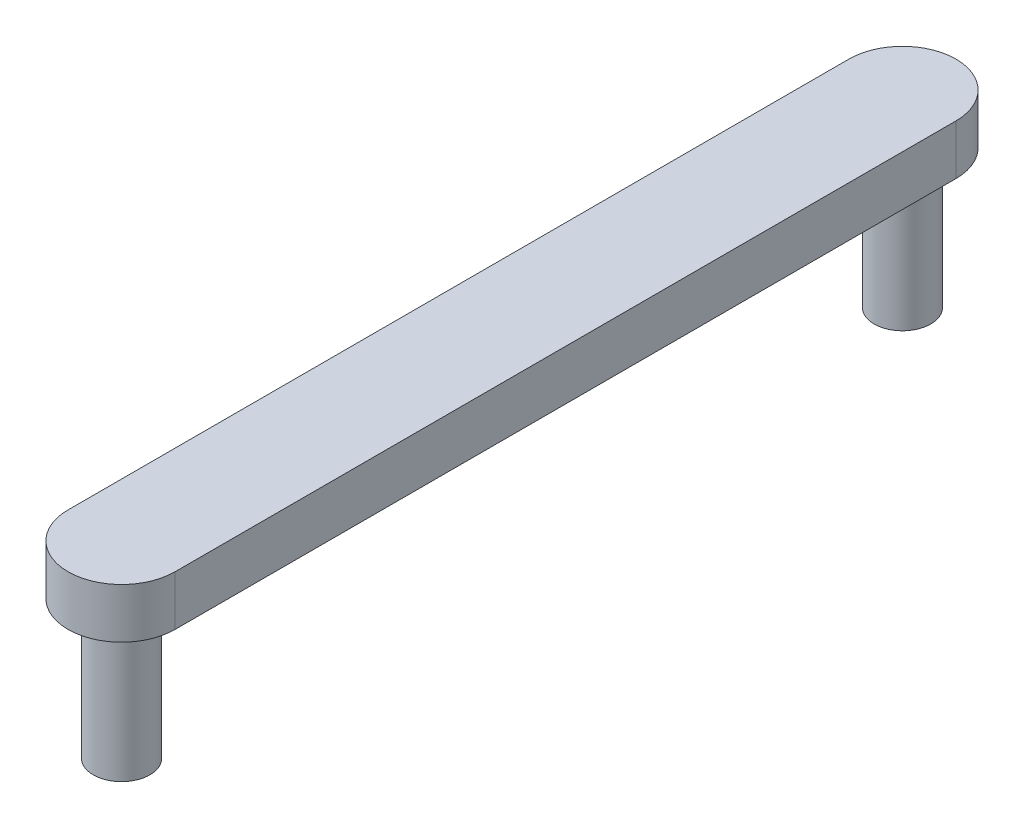
from build123d import *

# Parameters (mm, degrees)
SKETCH1_R             = 0.9
BOSS_EXTRUDE1_DEPTH   = 4.4
BOSS_EXTRUDE1_2_DEPTH = 4.4
BOSS_EXTRUDE2_DEPTH   = 1.5875


with BuildPart() as part:
    # Sketch1 → Boss-Extrude1 (new body)
    with BuildSketch(Plane(origin=(0, 0, 0), x_dir=(1, 0, 0), z_dir=(0, 1, 0))):
        with Locations(Location((0, 0, 0), (0, 0, 270))):
            Circle(SKETCH1_R)
    extrude(amount=BOSS_EXTRUDE1_DEPTH)



with BuildPart() as body_2:
    # Sketch1 → Boss-Extrude1 2 (new body)
    with BuildSketch(Plane(origin=(0, 0, 0), x_dir=(1, 0, 0), z_dir=(0, 1, 0))):
        with Locations(Location((0, -24.8, 0), (0, 0, 270))):
            Circle(SKETCH1_R)
    extrude(amount=BOSS_EXTRUDE1_2_DEPTH)


with BuildPart() as part_1:
    add(part.part)

    add(body_2.part)  # Boss-Extrude2 merges body 2
    # Sketch2 → Boss-Extrude2 (add)
    with BuildSketch(Plane(origin=(0, 4.4, 0), x_dir=(1, 0, 0), z_dir=(0, 1, 0))):
        with BuildLine():
            Line((1.7, 0), (1.7, -24.8))
            ThreePointArc((1.7, -24.8), (0, -26.5), (-1.7, -24.8))
            Line((-1.7, -24.8), (-1.7, 0))
            ThreePointArc((-1.7, 0), (0, 1.7), (1.7, 0))
        make_face()
    extrude(amount=BOSS_EXTRUDE2_DEPTH)


solid = part_1.part
